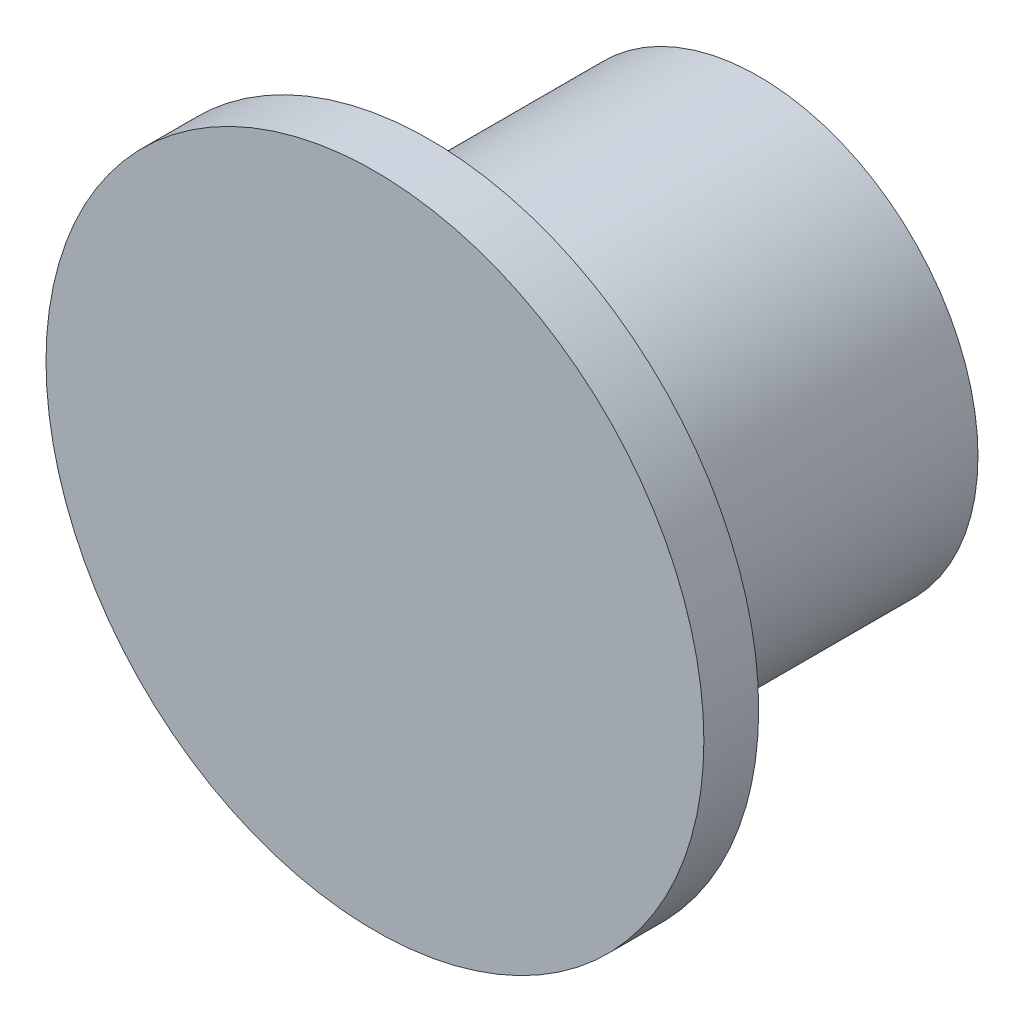
from build123d import *

# Parameters (mm, degrees)
CROQUIS2_R              = 4
SALIENTE_EXTRUIR1_DEPTH = 6
CROQUIS3_R              = 6
SALIENTE_EXTRUIR2_DEPTH = 1


with BuildPart() as part:
    # Croquis2 → Saliente-Extruir1 (new body)
    with BuildSketch(Plane.XY):
        Circle(CROQUIS2_R)
    extrude(amount=SALIENTE_EXTRUIR1_DEPTH)

    # Croquis3 → Saliente-Extruir2 (add)
    with BuildSketch(Plane.XY.offset(6)):
        Circle(CROQUIS3_R)
    extrude(amount=SALIENTE_EXTRUIR2_DEPTH)


solid = part.part
